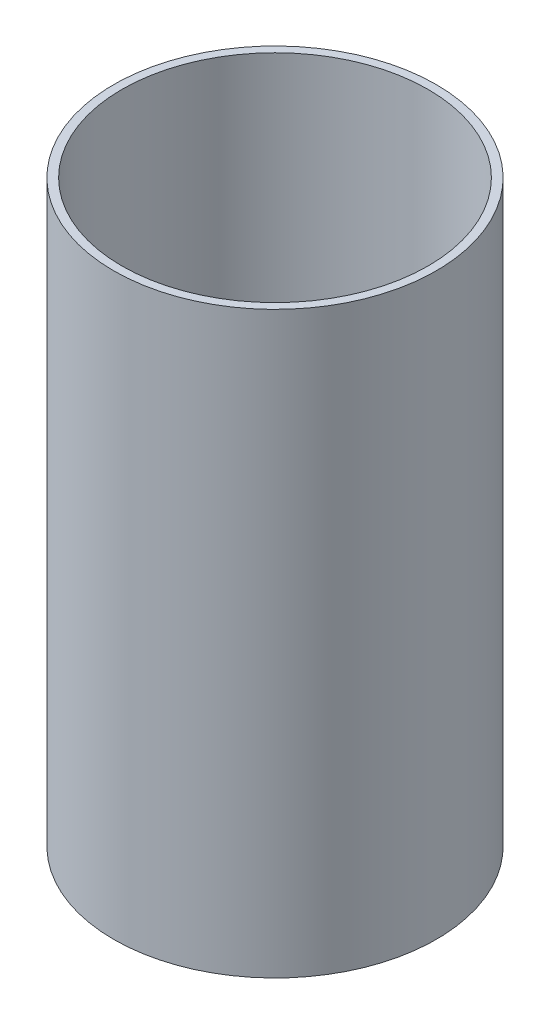
from build123d import *

# Parameters (mm, degrees)
SKETCH2_R           = 49.53
SKETCH2_R_2         = 46.99
BOSS_EXTRUDE1_DEPTH = 177.8


with BuildPart() as part:
    # Sketch2 → Boss-Extrude1 (new body)
    with BuildSketch(Plane(origin=(0, 0, 0), x_dir=(1, 0, 0), z_dir=(0, 1, 0))):
        with Locations(Location((0, 0, 0), (0, 0, 270))):
            Circle(SKETCH2_R)
        with Locations(Location((0, 0, 0), (0, 0, 270))):
            Circle(SKETCH2_R_2, mode=Mode.SUBTRACT)
    extrude(amount=BOSS_EXTRUDE1_DEPTH)


solid = part.part
